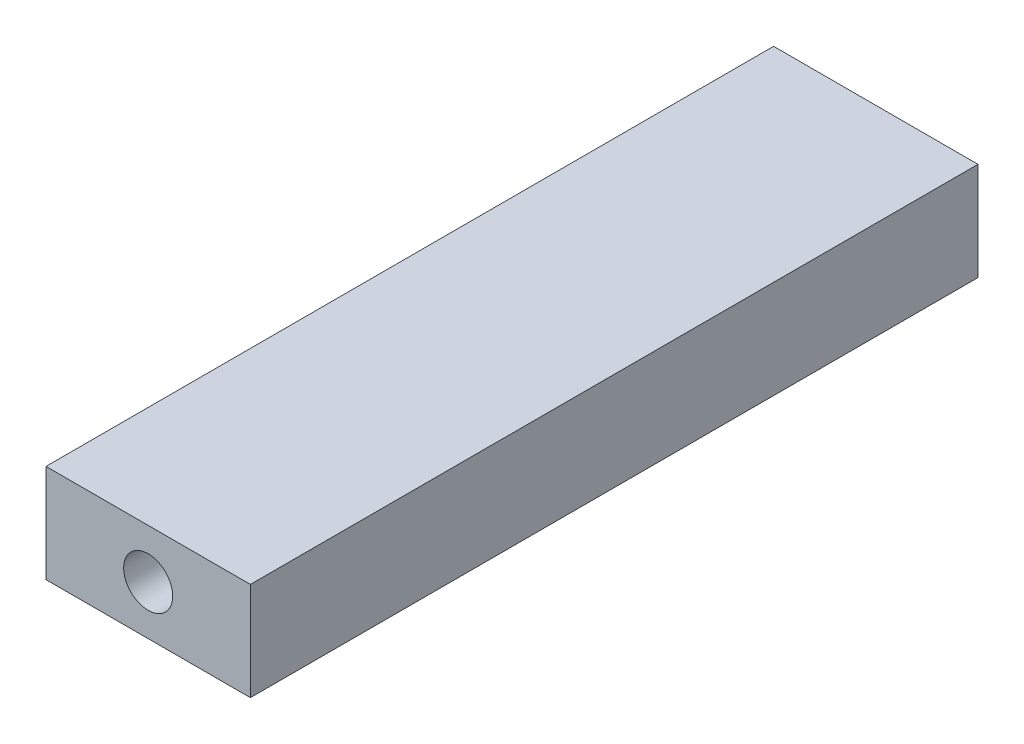
from build123d import *

# Parameters (mm, degrees)
SKETCH_1_W          = 10
SKETCH_1_H          = 4.8
EXTRUDE_1_DEPTH     = 35.6
SKETCH_2_R          = 1.2
CUT_EXTRUDE_1_DEPTH = 38.288067797


with BuildPart() as part:
    # 草图1 → 凸台-拉伸1 (new body)
    with BuildSketch(Plane.XY):
        with Locations((5, -2.4)):
            Rectangle(SKETCH_1_W, SKETCH_1_H)
    extrude(amount=EXTRUDE_1_DEPTH)

    # 草图2 → 切除-拉伸1 (cut, through all)
    with BuildSketch(Plane.XY.offset(35.6)):
        with Locations((5, -2.4)):
            Circle(SKETCH_2_R)
    extrude(amount=-CUT_EXTRUDE_1_DEPTH, mode=Mode.SUBTRACT)


solid = part.part
